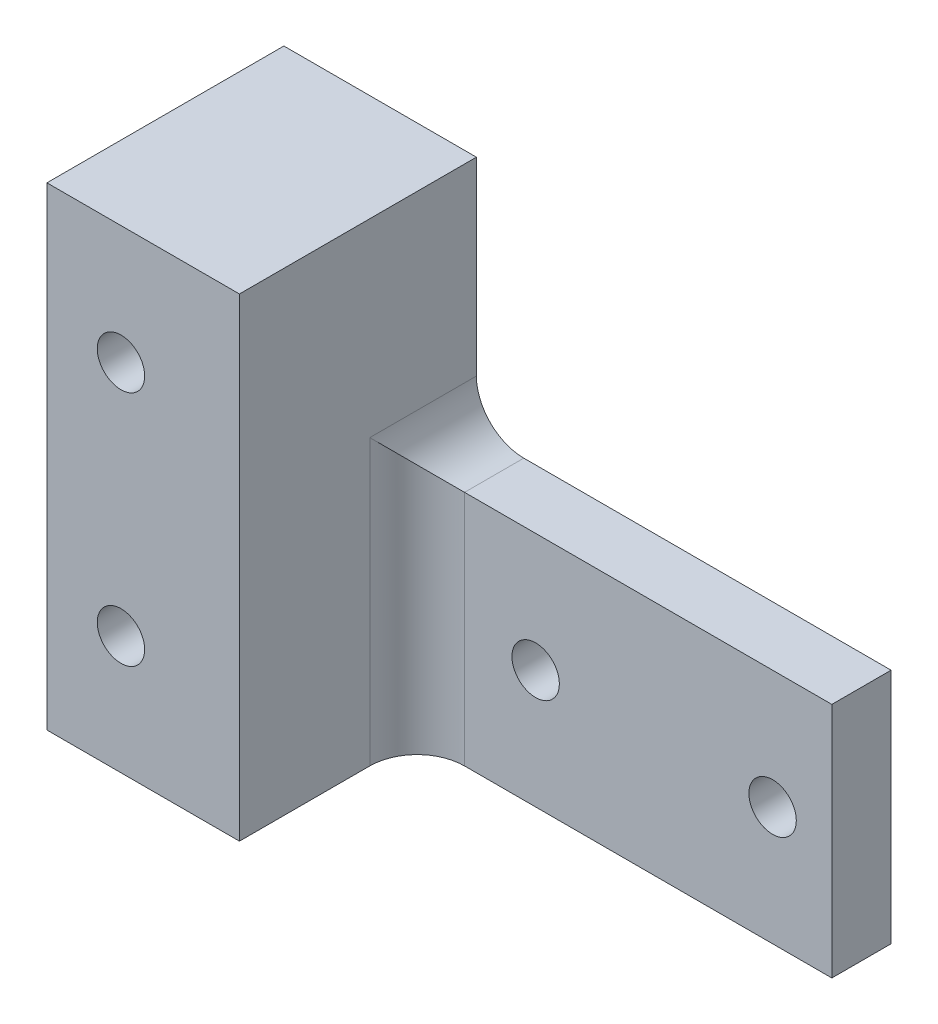
from build123d import *

# Parameters (mm, degrees)
BOSS_EXTRUDE1_DEPTH = 25.4
SKETCH2_R           = 2.54
CUT_EXTRUDE1_DEPTH  = 91.02678768
SKETCH3_W           = 4.7625
SKETCH3_H           = 50.8
CUT_EXTRUDE2_DEPTH  = 91.02678768
SKETCH4_W           = 44.45
SKETCH4_H           = 19.05
CUT_EXTRUDE3_DEPTH  = 91.02678768
FILLET1_R           = 5.08
SKETCH6_R           = 4.064
CUT_EXTRUDE5_DEPTH  = 7.62


with BuildPart() as part:
    # Sketch1 → Boss-Extrude1 (new body)
    with BuildSketch(Plane.XY):
        Polygon((0, 0), (0, 50.8), (25.4, 50.8), (25.4, 25.4), (69.85, 25.4), (69.85, 0), align=None)
    extrude(amount=BOSS_EXTRUDE1_DEPTH)

    # Sketch2 → Cut-Extrude1 (cut, through all)
    with BuildSketch(Plane.XY.offset(25.4)):
        with Locations((12.7, 38.1)):
            Circle(SKETCH2_R)
        with Locations((12.7, 12.7)):
            Circle(SKETCH2_R)
        with Locations((38.1, 12.7)):
            Circle(SKETCH2_R)
        with Locations((63.5, 12.7)):
            Circle(SKETCH2_R)
    extrude(amount=-CUT_EXTRUDE1_DEPTH, mode=Mode.SUBTRACT)

    # Sketch3 → Cut-Extrude2 (cut, through all)
    with BuildSketch(Plane.XY.offset(25.4)):
        with Locations((2.38125, 25.4)):
            Rectangle(SKETCH3_W, SKETCH3_H)
    extrude(amount=-CUT_EXTRUDE2_DEPTH, mode=Mode.SUBTRACT)

    # Sketch4 → Cut-Extrude3 (cut, through all)
    with BuildSketch(Plane.XZ):
        with Locations((47.625, 15.875)):
            Rectangle(SKETCH4_W, SKETCH4_H)
    extrude(amount=-CUT_EXTRUDE3_DEPTH, mode=Mode.SUBTRACT)

    # Fillet1
    fillet1_edges = [part.edges().sort_by_distance(p)[0] for p in [
        (25.4, 25.4, 3.175),
        (25.4, 12.7, 6.35),
    ]]
    fillet(fillet1_edges, radius=FILLET1_R)

    # Sketch6 → Cut-Extrude5 (cut)
    with BuildSketch(Plane(origin=(0, 0, 0), x_dir=(-1, 0, 0), z_dir=(0, 0, -1))):
        with Locations((-12.7, 38.1)):
            Circle(SKETCH6_R)
    extrude(amount=-CUT_EXTRUDE5_DEPTH, mode=Mode.SUBTRACT)


solid = part.part
